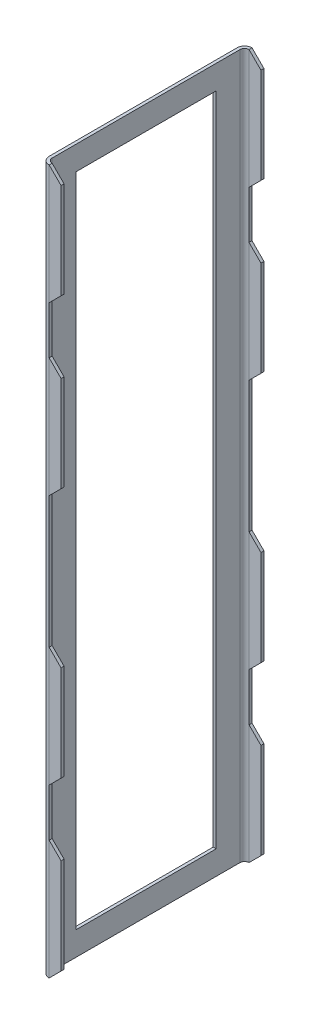
from build123d import *

# Parameters (mm, degrees)
MAINPLATEEXTRUDE_DEPTH = 374.65
FLANGECUT_DEPTH        = 107.95
SKETCH3_W              = 74.5998
SKETCH3_H              = 349.25
CUT_EXTRUDE2_DEPTH     = 1.5875


with BuildPart() as part:
    # Sketch1 → MainPlateExtrude (new body)
    with BuildSketch(Plane(origin=(0, 0, 0), x_dir=(1, 0, 0), z_dir=(0, 1, 0))):
        with BuildLine():
            Line((-47.61865, -52.38115), (-41.26865, -52.38115))
            Line((-41.26865, -52.38115), (-41.26865, -53.96865))
            Line((-41.26865, -53.96865), (-47.61865, -53.96865))
            ThreePointArc((-47.61865, -53.96865), (-50.424980038, -52.806230038), (-51.5874, -49.9999))
            Line((-51.5874, -49.9999), (-51.5874, 49.9999))
            ThreePointArc((-51.5874, 49.9999), (-50.424980038, 52.806230038), (-47.61865, 53.96865))
            Line((-47.61865, 53.96865), (-41.26865, 53.96865))
            Line((-41.26865, 53.96865), (-41.26865, 52.38115))
            Line((-41.26865, 52.38115), (-47.61865, 52.38115))
            ThreePointArc((-47.61865, 52.38115), (-49.302448023, 51.683698023), (-49.9999, 49.9999))
            Line((-49.9999, 49.9999), (-49.9999, -49.9999))
            ThreePointArc((-49.9999, -49.9999), (-49.302448023, -51.683698023), (-47.61865, -52.38115))
        make_face()
    extrude(amount=MAINPLATEEXTRUDE_DEPTH)

    # Sketch2 → FlangeCut (cut)
    with BuildSketch(Plane.XY.offset(53.96865)):
        Polygon((-41.26865, 95.25), (-47.61865, 88.9), (-47.61865, 63.5), (-41.26865, 57.15), align=None)
        Polygon((-41.26865, 6.35), (-47.61865, 0), (-41.26865, 0), align=None)
        Polygon((-41.26865, 228.6), (-47.61865, 222.25), (-47.61865, 152.4), (-41.26865, 146.05), align=None)
        Polygon((-41.26865, 317.5), (-47.61865, 311.15), (-47.61865, 285.75), (-41.26865, 279.4), align=None)
        Polygon((-41.26865, 374.65), (-47.61865, 374.65), (-41.26865, 368.3), align=None)
    extrude(amount=-FLANGECUT_DEPTH, mode=Mode.SUBTRACT)

    # Sketch3 → Cut-Extrude2 (cut)
    with BuildSketch(Plane.ZY.offset(51.5874)):
        with Locations((0, 187.325)):
            Rectangle(SKETCH3_W, SKETCH3_H)
    extrude(amount=-CUT_EXTRUDE2_DEPTH, mode=Mode.SUBTRACT)


solid = part.part
